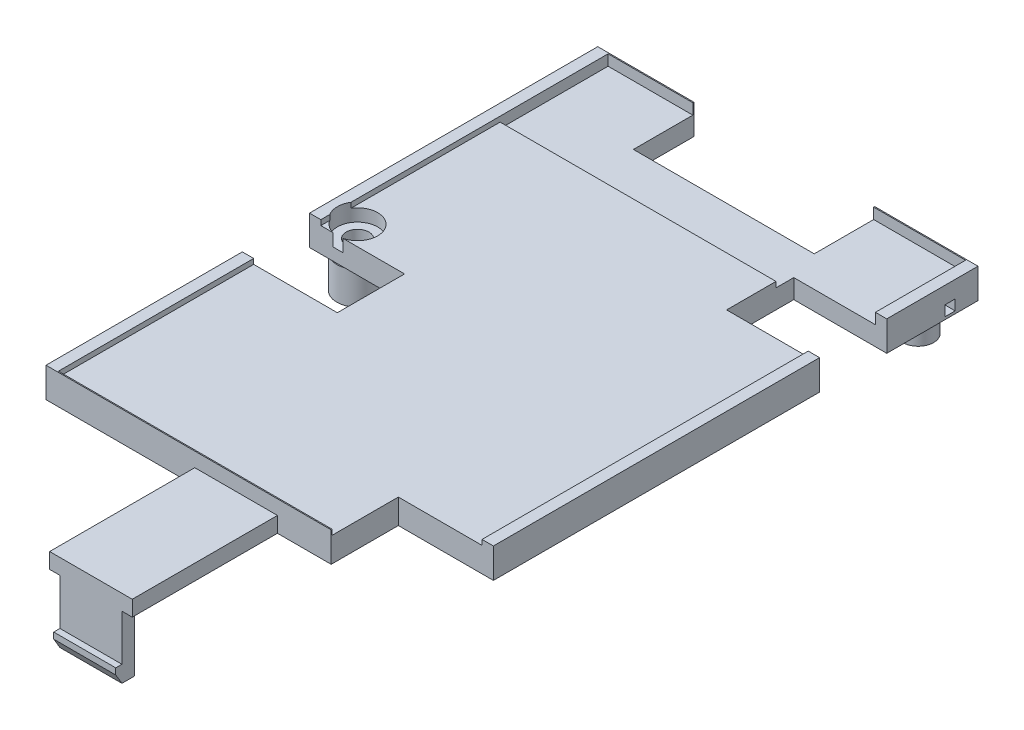
from build123d import *

# Parameters (mm, degrees)
TRAY_START                        = 4.75
SKETCH1_W                         = 36.8
SKETCH1_H                         = 53.4
TRAY_DEPTH                        = 2.89
GROOVE_START                      = 7.14
SKETCH2_W                         = 34.6
SKETCH2_H                         = 53.2
GROOVE_DEPTH                      = 0.6
GROOVE_START_2                    = 6.6
SKETCH3_W                         = 34.6
SKETCH3_H                         = 10.45
GROOVE_PROTECTION_BOARD_END_DEPTH = 0.55
S1_S3_START                       = 4.65
SKETCH4_W                         = 9.25
SKETCH4_H                         = 6.5
SKETCH4_W_2                       = 9.05
S1_S3_AND_PLUGS_DEPTH             = 3.09
J4_START                          = 4.65
SKETCH5_W                         = 17.5
SKETCH5_H                         = 6
J4_AND_ITS_FLEX_DEPTH             = 3.09
ARM_START                         = 4.75
SKETCH6_W                         = 8
SKETCH6_H                         = 14.2
ARM_DEPTH                         = 1.5
BOARD_START                       = 1.6
SKETCH7_R                         = 2
BOARD_SCREW_FOOT_DEPTH            = 3.16
BOARD_START_2                     = 1.5
SKETCH8_R                         = 1.1
BOARD_SCREW_HOLE_DEPTH            = 6.24
BOARD_START_3                     = 5.94
SKETCH9_R                         = 1.95
BOARD_SCREW_COUNTERBORE_DEPTH     = 1.8
MIC_START                         = 1.8
SKETCH10_R                        = 1.5
MIC_TUBE_DEPTH                    = 2.96
MIC_START_2                       = 1.7
SKETCH11_R                        = 0.5
MIC_BORE_DEPTH                    = 4.3
MIC_START_3                       = 5
SKETCH12_W                        = 3.68
SKETCH12_H                        = 1
MIC_DUCT_DEPTH                    = 1
SNAP_START                        = -3
SNAP_DEPTH                        = 6


with BuildPart() as part:
    # Sketch1 → Tray (new body)
    with BuildSketch(Plane(origin=(0, 0, 0), x_dir=(1, 0, 0), z_dir=(0, 1, 0)).offset(TRAY_START)):
        with Locations((0, 5.95)):
            Rectangle(SKETCH1_W, SKETCH1_H)
    extrude(amount=TRAY_DEPTH)

    # Sketch2 → Groove (cut)
    with BuildSketch(Plane(origin=(0, 0, 0), x_dir=(1, 0, 0), z_dir=(0, 1, 0)).offset(GROOVE_START)):
        with Locations((0, 5.95)):
            Rectangle(SKETCH2_W, SKETCH2_H)
    extrude(amount=GROOVE_DEPTH, mode=Mode.SUBTRACT)

    # Sketch3 → Groove, protection-board end (cut)
    with BuildSketch(Plane(origin=(0, 0, 0), x_dir=(1, 0, 0), z_dir=(0, 1, 0)).offset(GROOVE_START_2)):
        with Locations((0, 27.325)):
            Rectangle(SKETCH3_W, SKETCH3_H)
    extrude(amount=GROOVE_PROTECTION_BOARD_END_DEPTH, mode=Mode.SUBTRACT)

    # Sketch4 → S1-S3 and plugs (cut)
    with BuildSketch(Plane(origin=(0, 0, 0), x_dir=(1, 0, 0), z_dir=(0, 1, 0)).offset(S1_S3_START)):
        with Locations((-13.825, 1.5)):
            Rectangle(SKETCH4_W, SKETCH4_H)
        with Locations((13.925, 20.57)):
            Rectangle(SKETCH4_W_2, SKETCH4_H)
        with Locations((13.825, -17.5)):
            Rectangle(SKETCH4_W, SKETCH4_H)
    extrude(amount=S1_S3_AND_PLUGS_DEPTH, mode=Mode.SUBTRACT)

    # Sketch5 → J4 and its flex (cut)
    with BuildSketch(Plane(origin=(0, 0, 0), x_dir=(1, 0, 0), z_dir=(0, 1, 0)).offset(J4_START)):
        with Locations((-0.35, 29.8)):
            Rectangle(SKETCH5_W, SKETCH5_H)
    extrude(amount=J4_AND_ITS_FLEX_DEPTH, mode=Mode.SUBTRACT)

    # Sketch6 → Arm (add)
    with BuildSketch(Plane(origin=(0, 0, 0), x_dir=(1, 0, 0), z_dir=(0, 1, 0)).offset(ARM_START)):
        with Locations((0, -27.7)):
            Rectangle(SKETCH6_W, SKETCH6_H)
    extrude(amount=ARM_DEPTH)

    # Sketch7 → Board screw foot (add)
    with BuildSketch(Plane(origin=(0, 0, 0), x_dir=(1, 0, 0), z_dir=(0, 1, 0)).offset(BOARD_START)):
        with Locations(Location((-15.64, 6.64, 0), (0, 0, 289.091052509))):
            Circle(SKETCH7_R)
    extrude(amount=BOARD_SCREW_FOOT_DEPTH)

    # Sketch8 → Board screw hole (cut)
    with BuildSketch(Plane(origin=(0, 0, 0), x_dir=(1, 0, 0), z_dir=(0, 1, 0)).offset(BOARD_START_2)):
        with Locations(Location((-15.64, 6.64, 0), (0, 0, 90))):
            Circle(SKETCH8_R)
    extrude(amount=BOARD_SCREW_HOLE_DEPTH, mode=Mode.SUBTRACT)

    # Sketch9 → Board screw counterbore (cut)
    with BuildSketch(Plane(origin=(0, 0, 0), x_dir=(1, 0, 0), z_dir=(0, 1, 0)).offset(BOARD_START_3)):
        with Locations((-15.64, 6.64)):
            Circle(SKETCH9_R)
    extrude(amount=BOARD_SCREW_COUNTERBORE_DEPTH, mode=Mode.SUBTRACT)

    # Sketch10 → Mic tube (add)
    with BuildSketch(Plane(origin=(0, 0, 0), x_dir=(1, 0, 0), z_dir=(0, 1, 0)).offset(MIC_START)):
        with Locations(Location((15.32, 29.94, 0), (0, 0, 270))):
            Circle(SKETCH10_R)
    extrude(amount=MIC_TUBE_DEPTH)

    # Sketch11 → Mic bore (cut)
    with BuildSketch(Plane(origin=(0, 0, 0), x_dir=(1, 0, 0), z_dir=(0, 1, 0)).offset(MIC_START_2)):
        with Locations(Location((15.32, 29.94, 0), (0, 0, 270))):
            Circle(SKETCH11_R)
    extrude(amount=MIC_BORE_DEPTH, mode=Mode.SUBTRACT)

    # Sketch12 → Mic duct (cut)
    with BuildSketch(Plane(origin=(0, 0, 0), x_dir=(1, 0, 0), z_dir=(0, 1, 0)).offset(MIC_START_3)):
        with Locations((16.66, 29.94)):
            Rectangle(SKETCH12_W, SKETCH12_H)
    extrude(amount=MIC_DUCT_DEPTH, mode=Mode.SUBTRACT)

    # Sketch13 → Snap (add)
    with BuildSketch(Plane(origin=(0, 0, 0), x_dir=(0, 0, -1), z_dir=(1, 0, 0)).offset(SNAP_START)):
        Polygon((-33.6, 5.25), (-34.8, 5.25), (-34.8, 0.3), (-35.4, 0.3), (-35.4, -0.3), (-34.8, -1.3), (-33.6, -1.3), align=None)
    extrude(amount=SNAP_DEPTH)


solid = part.part
